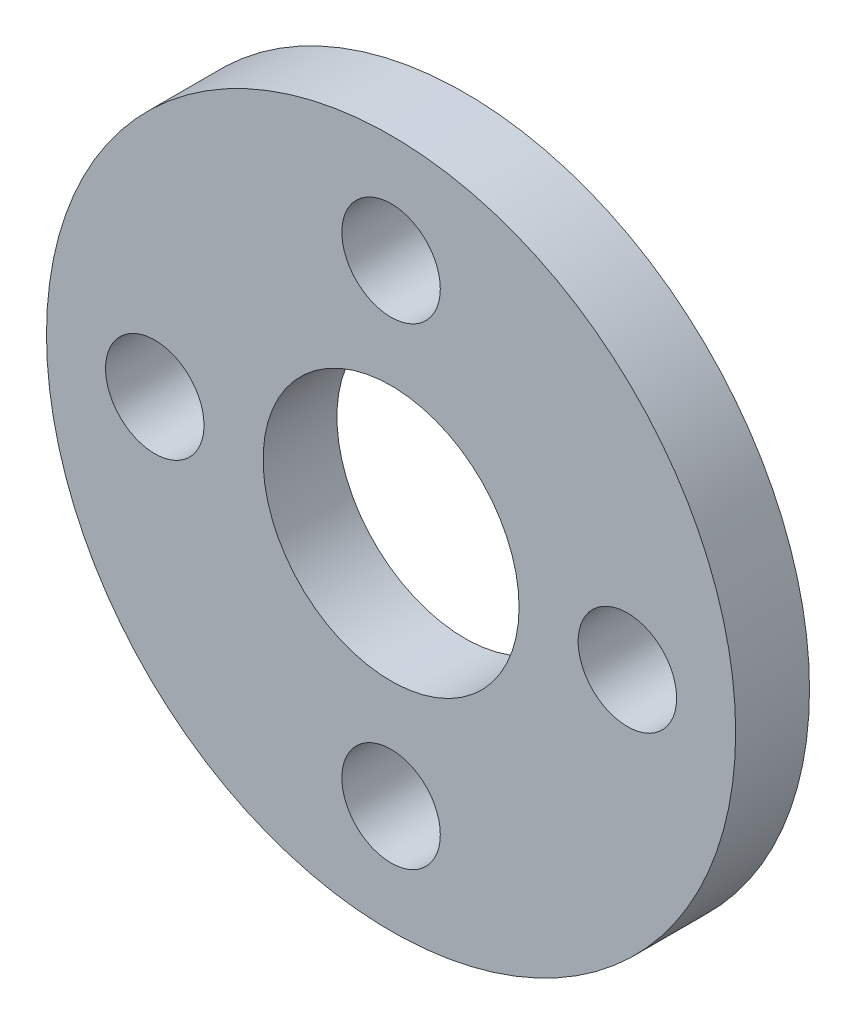
from build123d import *

# Parameters (mm, degrees)
SKETCH_1_R      = 7
SKETCH_1_R_2    = 2.6
SKETCH_1_R_3    = 1
EXTRUDE_1_DEPTH = 1.5


with BuildPart() as part:
    # Эскиз1 → Бобышка-Вытянуть1 (new body)
    with BuildSketch(Plane.XY):
        Circle(SKETCH_1_R)
        Circle(SKETCH_1_R_2, mode=Mode.SUBTRACT)
        with Locations((-4.8, 0)):
            Circle(SKETCH_1_R_3, mode=Mode.SUBTRACT)
        with Locations((0, 4.8)):
            Circle(SKETCH_1_R_3, mode=Mode.SUBTRACT)
        with Locations((4.8, 0)):
            Circle(SKETCH_1_R_3, mode=Mode.SUBTRACT)
        with Locations((0, -4.8)):
            Circle(SKETCH_1_R_3, mode=Mode.SUBTRACT)
    extrude(amount=EXTRUDE_1_DEPTH)


solid = part.part
